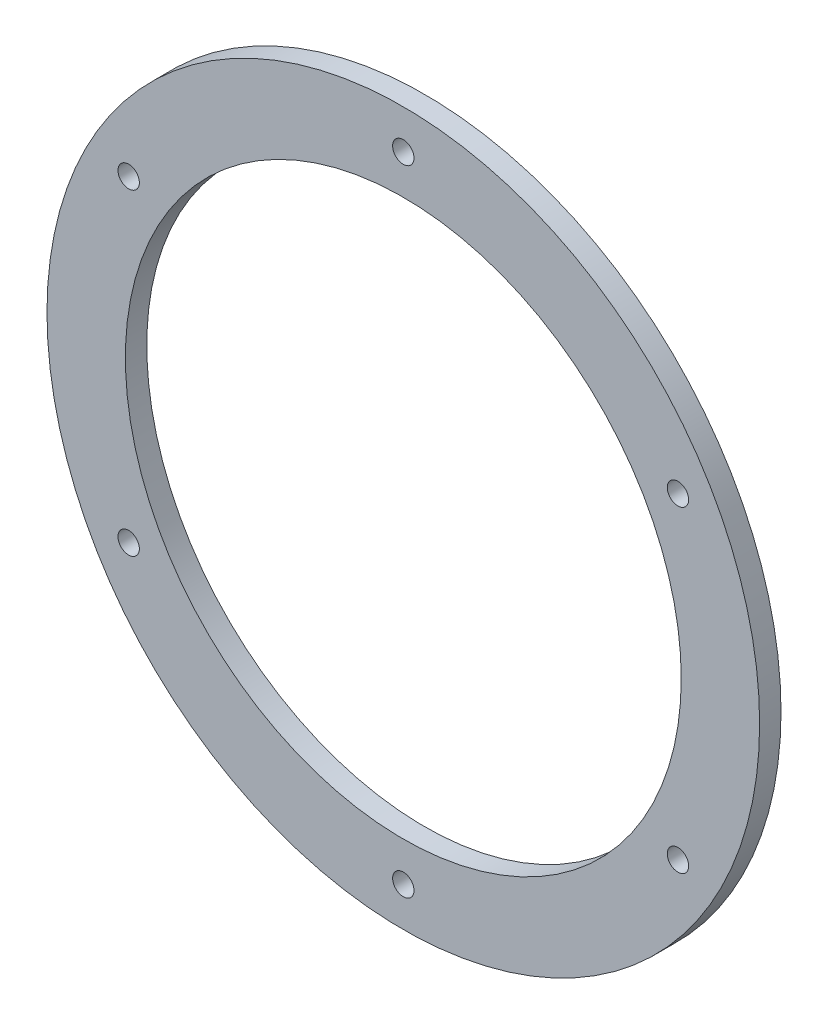
from build123d import *

# Parameters (mm, degrees)
SKETCH_1_R          = 50
SKETCH_1_R_2        = 39
EXTRUDE_1_DEPTH     = 3
SKETCH_2_R          = 1.5
CUT_EXTRUDE_1_DEPTH = 3


with BuildPart() as part:
    # 草图1 → 凸台-拉伸1 (new body)
    with BuildSketch(Plane.XY):
        Circle(SKETCH_1_R)
        Circle(SKETCH_1_R_2, mode=Mode.SUBTRACT)
    extrude(amount=EXTRUDE_1_DEPTH)

    # 草图2 → 切除-拉伸1 (cut)
    with BuildSketch(Plane.XY.offset(3)):
        with Locations((0, 44.5)):
            Circle(SKETCH_2_R)
        with Locations((38.538130468, 22.25)):
            Circle(SKETCH_2_R)
        with Locations((38.538130468, -22.25)):
            Circle(SKETCH_2_R)
        with Locations((0, -44.5)):
            Circle(SKETCH_2_R)
        with Locations((-38.538130468, -22.25)):
            Circle(SKETCH_2_R)
        with Locations((-38.538130468, 22.25)):
            Circle(SKETCH_2_R)
    extrude(amount=-CUT_EXTRUDE_1_DEPTH, mode=Mode.SUBTRACT)


solid = part.part
